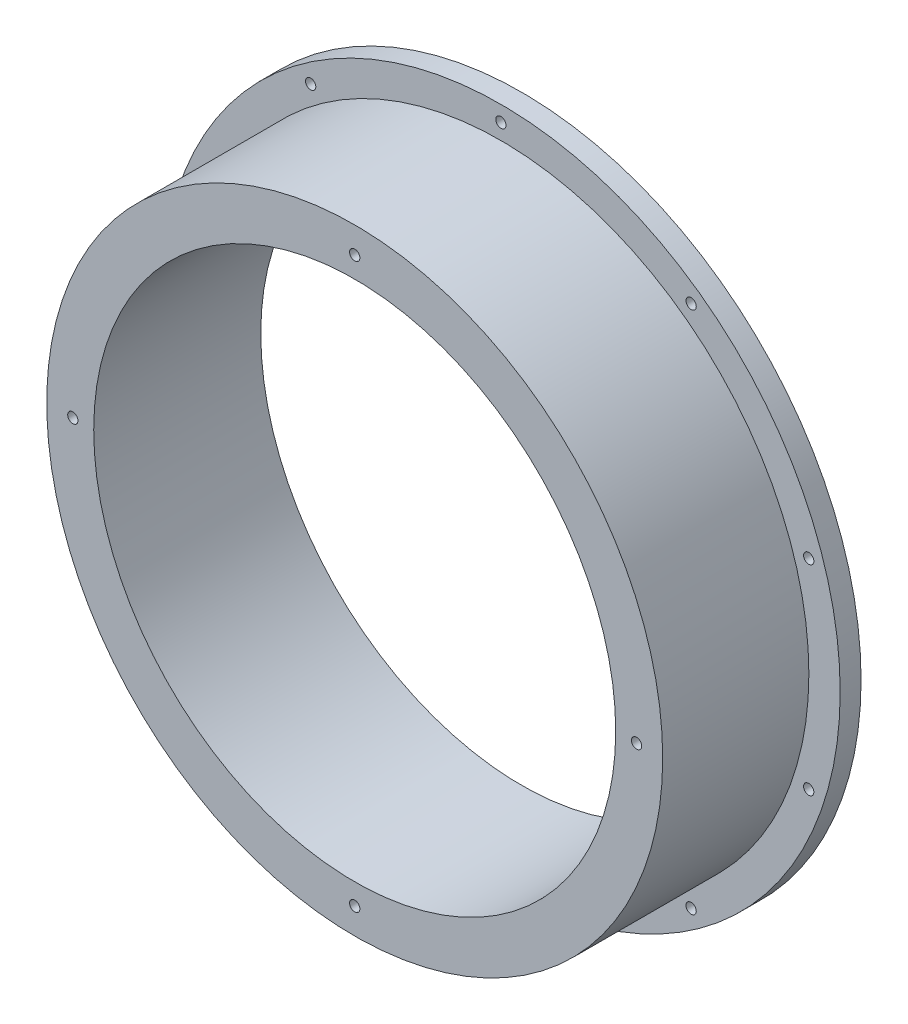
from build123d import *

# Parameters (mm, degrees)
SKETCH2_R                        = 1.25
INTERNAL_MOUNTING_HOLES_DEPTH    = 4
ENDCAP_MOUNTING_HOLES_DEPTH      = 124.614783097
ENDCAP_MOUNTING_HOLES_DEPTH_BACK = 124.614783097
SKETCH3_R                        = 1.25


with BuildPart() as part:
    # Sketch1 → Base Boss (revolve)
    with BuildSketch(Plane(origin=(0, 0, 0), x_dir=(1, 0, 0), z_dir=(0, 1, 0))):
        Polygon((63.5, 20.32), (82.55, 20.32), (82.55, 15.24), (74.93, 15.24), (74.93, -20.32), (63.5, -20.32), align=None)
    revolve(axis=Axis((0, 0, 0), (0, 0, -1)))

    # Sketch2 → Internal Mounting Holes (cut)
    with BuildSketch(Plane.XY.offset(20.32)):
        with Locations((0, 68.58)):
            Circle(SKETCH2_R)
        with Locations((68.58, 0)):
            Circle(SKETCH2_R)
        with Locations((0, -68.58)):
            Circle(SKETCH2_R)
        with Locations((-68.58, 0)):
            Circle(SKETCH2_R)
    extrude(amount=-INTERNAL_MOUNTING_HOLES_DEPTH, mode=Mode.SUBTRACT)

    # Sketch3 → Endcap Mounting Holes (cut, two sides: drawn at the far end of the back side and taken through both)
    with BuildSketch(Plane(origin=(0, 0, -20.32), x_dir=(-1, 0, 0), z_dir=(0, 0, -1)).offset(-ENDCAP_MOUNTING_HOLES_DEPTH_BACK)):
        with Locations((0, 78.74)):
            Circle(SKETCH3_R)
        with Locations((46.282210766, 63.701998137)):
            Circle(SKETCH3_R)
        with Locations((74.886190093, 24.331998137)):
            Circle(SKETCH3_R)
        with Locations((74.886190093, -24.331998137)):
            Circle(SKETCH3_R)
        with Locations((46.282210766, -63.701998137)):
            Circle(SKETCH3_R)
        with Locations((0, -78.74)):
            Circle(SKETCH3_R)
        with Locations((-46.282210766, -63.701998137)):
            Circle(SKETCH3_R)
        with Locations((-74.886190093, -24.331998137)):
            Circle(SKETCH3_R)
        with Locations((-74.886190093, 24.331998137)):
            Circle(SKETCH3_R)
        with Locations((-46.282210766, 63.701998137)):
            Circle(SKETCH3_R)
    extrude(amount=ENDCAP_MOUNTING_HOLES_DEPTH + ENDCAP_MOUNTING_HOLES_DEPTH_BACK, mode=Mode.SUBTRACT)


solid = part.part
